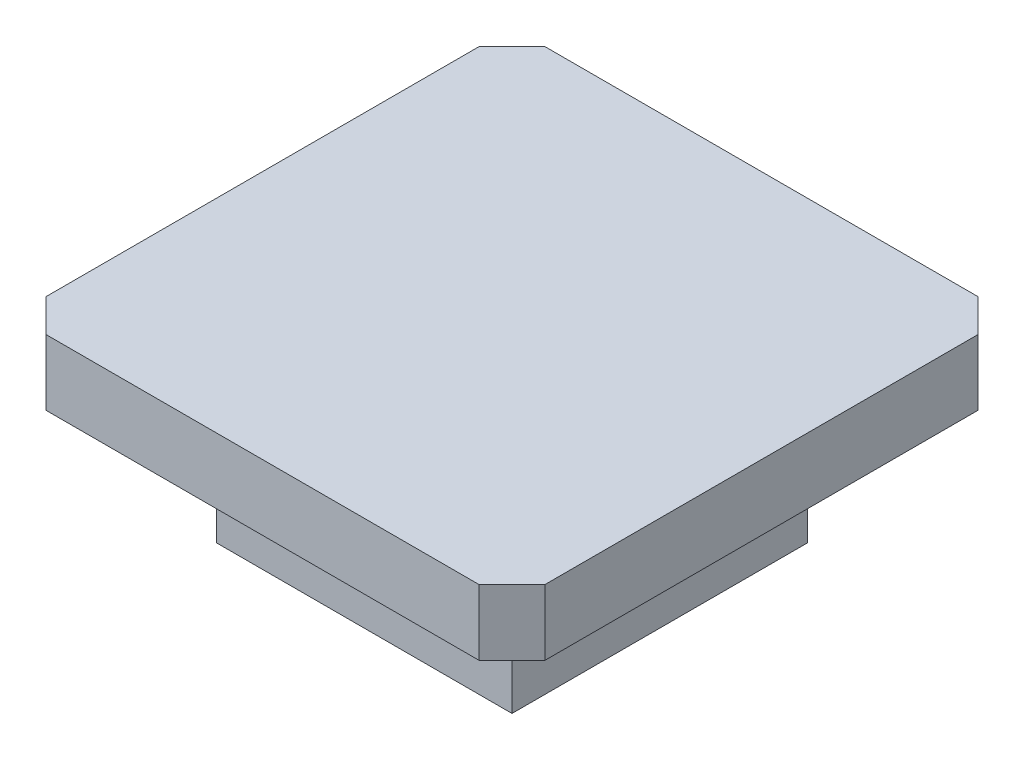
from build123d import *

# Parameters (mm, degrees)
SKETCH1_W           = 48.26
SKETCH1_H           = 48.26
BOSS_EXTRUDE1_DEPTH = 6.35
CHAMFER1_SIZE       = 3.175
SKETCH4_W           = 28.575
SKETCH4_H           = 28.575
BOSS_EXTRUDE2_DEPTH = 12.7
CHAMFER2_SIZE       = 1.5875


with BuildPart() as part:
    # Sketch1 → Boss-Extrude1 (new body)
    with BuildSketch(Plane(origin=(0, 0, 0), x_dir=(1, 0, 0), z_dir=(0, 1, 0))):
        with Locations((24.13, 24.13)):
            Rectangle(SKETCH1_W, SKETCH1_H)
    extrude(amount=BOSS_EXTRUDE1_DEPTH)

    # Chamfer1
    chamfer1_edges = [part.edges().sort_by_distance(p)[0] for p in [
        (48.26, 3.175, -48.26),
        (0, 3.175, -48.26),
        (0, 3.175, 0),
        (48.26, 3.175, 0),
    ]]
    chamfer(chamfer1_edges, length=CHAMFER1_SIZE)

    # Sketch4 → Boss-Extrude2 (add)
    with BuildSketch(Plane.XZ):
        with Locations((24.13, -24.13)):
            Rectangle(SKETCH4_W, SKETCH4_H)
    extrude(amount=BOSS_EXTRUDE2_DEPTH)

    # Chamfer2
    chamfer2_edges = [part.edges().sort_by_distance(p)[0] for p in [
        (24.13, 0, -9.8425),
        (38.4175, 0, -24.13),
        (24.13, 0, -38.4175),
        (9.8425, 0, -24.13),
    ]]
    chamfer(chamfer2_edges, length=CHAMFER2_SIZE)


solid = part.part
